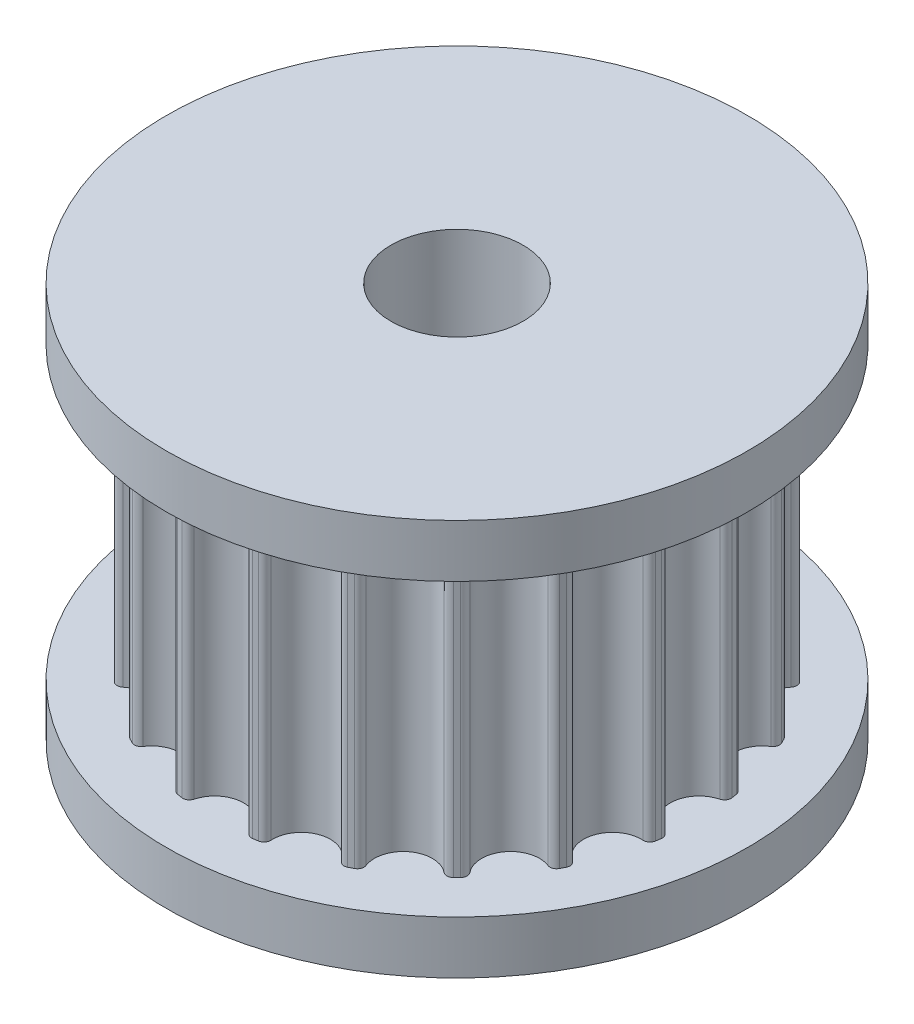
from build123d import *

# Parameters (mm, degrees)
SKETCH_1_R               = 9.17
EXTRUDE_1_DEPTH          = 11
CUT_EXTRUDE_1_DEPTH      = 11
PATTERN_CIRCULAR_1_COUNT = 20
SKETCH_4_R               = 11
EXTRUDE_3_DEPTH          = 2
EXTRUDE_START            = 2
SKETCH_3_R               = 11
EXTRUDE_4_DEPTH          = 2
SKETCH_5_R               = 2.5
CUT_EXTRUDE_2_DEPTH      = 22


with BuildPart() as part:
    # 草图1 → 凸台-拉伸1 (new body)
    with BuildSketch(Plane(origin=(0, 0, 0), x_dir=(1, 0, 0), z_dir=(0, 1, 0))):
        with Locations(Location((0, 0, 0), (0, 0, 270))):
            Circle(SKETCH_1_R)
    extrude(amount=-EXTRUDE_1_DEPTH)

    # 草图2 → 切除-拉伸1 (cut)
    with BuildSketch(Plane(origin=(0, 0, 0), x_dir=(1, 0, 0), z_dir=(0, 1, 0))):
        with BuildLine():
            Line((-1.338469592, 9.071791397), (-1.301979145, 9.548134799))
            Line((-1.301979145, 9.548134799), (1.164461041, 9.508969944))
            Line((1.164461041, 9.508969944), (1.338469592, 9.071791397))
            ThreePointArc((1.338469592, 9.071791397), (1.164461041, 9.03324808), (1.06034373, 8.888596261))
            ThreePointArc((1.06034373, 8.888596261), (0, 8.072950826), (-1.06034373, 8.888596261))
            ThreePointArc((-1.06034373, 8.888596261), (-1.164461041, 9.03324808), (-1.338469592, 9.071791397))
        make_face()
    cut_extrude_1 = extrude(amount=-CUT_EXTRUDE_1_DEPTH, mode=Mode.SUBTRACT)

    # 阵列(圆周)1: 切除-拉伸1 ×20 about axis
    pattern_circular_1_axis = Axis((0, 0, 0), (0, 1, 0))
    for i in range(1, PATTERN_CIRCULAR_1_COUNT):
        add(cut_extrude_1.rotate(pattern_circular_1_axis, i * 360 / PATTERN_CIRCULAR_1_COUNT), mode=Mode.SUBTRACT)

    # 草图4 → 凸台-拉伸3 (add)
    with BuildSketch(Plane(origin=(0, 0, 0), x_dir=(1, 0, 0), z_dir=(0, 1, 0))):
        with Locations(Location((0, 0, 0), (0, 0, 270))):
            Circle(SKETCH_4_R)
    extrude(amount=EXTRUDE_3_DEPTH)

    # 草图3 → 凸台-拉伸4 (add)
    with BuildSketch(Plane.XZ.offset(11).offset(EXTRUDE_START)):
        with Locations(Location((0, 0, 0), (0, 0, 90))):
            Circle(SKETCH_3_R)
    extrude(amount=-EXTRUDE_4_DEPTH)

    # 草图5 → 切除-拉伸2 (cut)
    with BuildSketch(Plane(origin=(0, 2, 0), x_dir=(1, 0, 0), z_dir=(0, 1, 0))):
        with Locations(Location((0, 0, 0), (0, 0, 270))):
            Circle(SKETCH_5_R)
    extrude(amount=-CUT_EXTRUDE_2_DEPTH, mode=Mode.SUBTRACT)


solid = part.part
